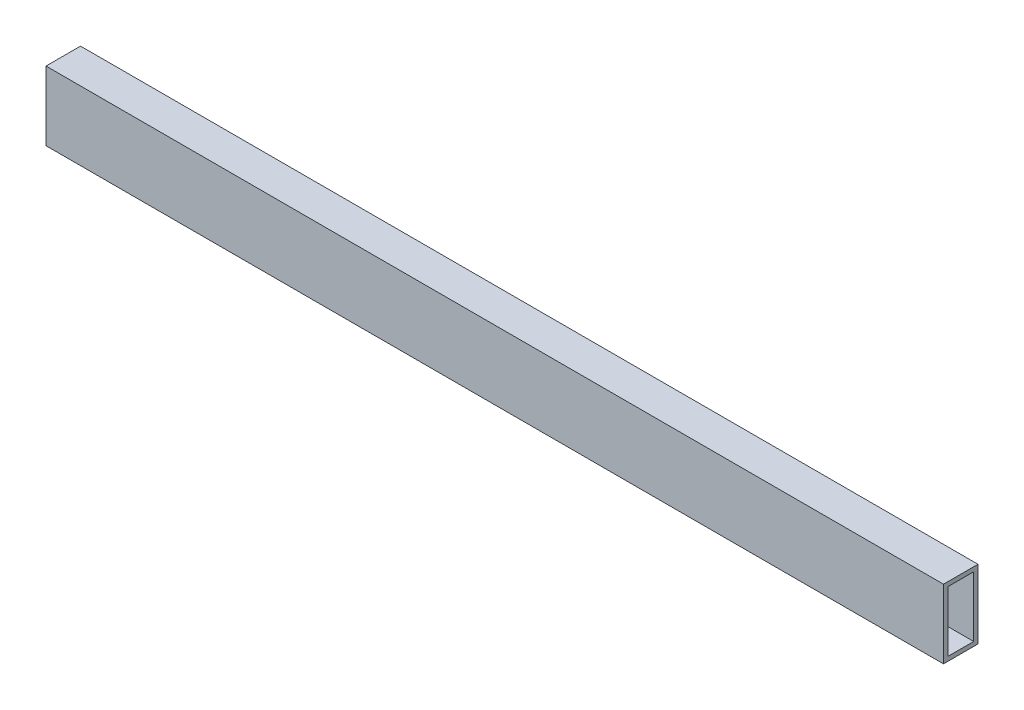
from build123d import *

# Parameters (mm, degrees)
SKETCH1_W           = 25.4
SKETCH1_H           = 50.8
SKETCH1_W_2         = 19.05
SKETCH1_H_2         = 44.45
BOSS_EXTRUDE1_DEPTH = 330.2


with BuildPart() as part:
    # Sketch1 → Boss-Extrude1 (new body)
    with BuildSketch(Plane(origin=(0, 0, 0), x_dir=(0, 0, -1), z_dir=(1, 0, 0))):
        with Locations((-368.3, 0)):
            Rectangle(SKETCH1_W, SKETCH1_H)
        with Locations((-368.3, 0)):
            Rectangle(SKETCH1_W_2, SKETCH1_H_2, mode=Mode.SUBTRACT)
    boss_extrude1 = extrude(amount=BOSS_EXTRUDE1_DEPTH)

    # Mirror1: Boss-Extrude1 across plane
    add(boss_extrude1.mirror(Plane(origin=(0, 0, 0), x_dir=(0, 0, 1), z_dir=(1, 0, 0))))


solid = part.part
